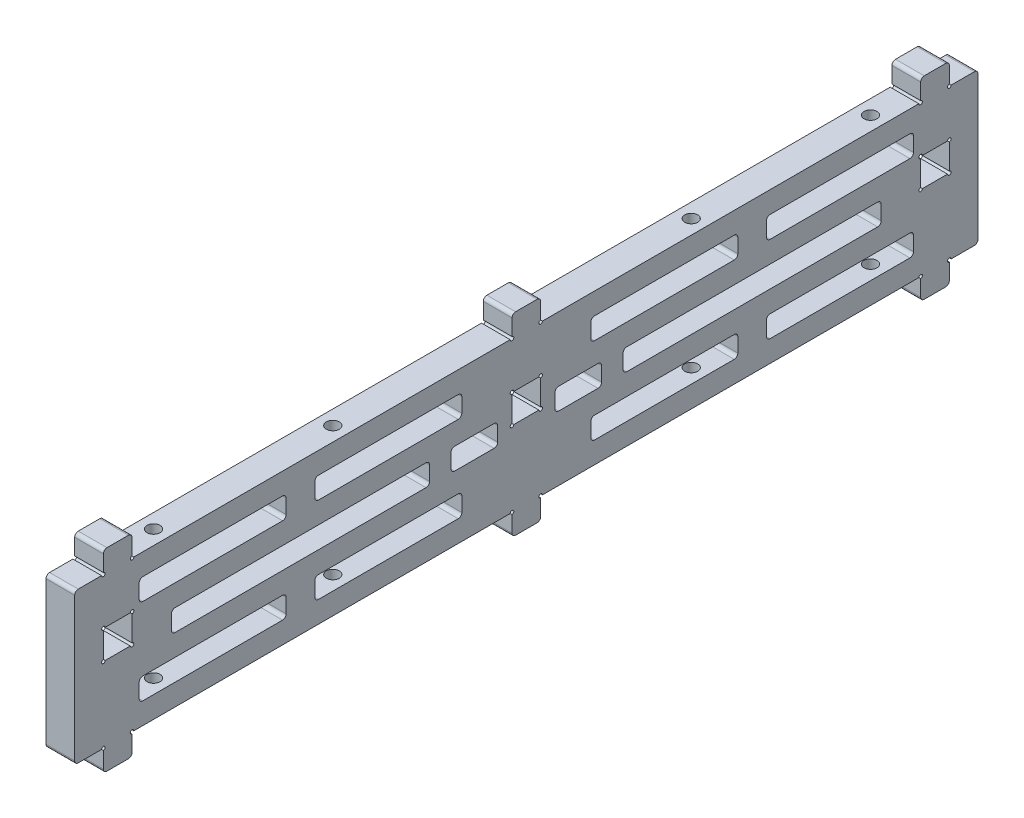
from build123d import *

# Parameters (mm, degrees)
SKETCH_1_W          = 126
SKETCH_1_H          = 21
SKETCH_1_W_2        = 4
SKETCH_1_H_2        = 4
EXTRUDE_1_DEPTH     = 4
EXTRUDE_2_DEPTH     = 4
SKETCH_3_R          = 0.25
CUT_EXTRUDE_1_DEPTH = 4
CUT_EXTRUDE_2_DEPTH = 4
FILLET_1_R          = 0.5
CUT_EXTRUDE_3_REACH = 69.535
SKETCH_5_R          = 0.9


with BuildPart() as part:
    # 草图1 → 凸台-拉伸1 (new body)
    with BuildSketch(Plane(origin=(0, 0, 0), x_dir=(0, 0, -1), z_dir=(1, 0, 0))):
        Rectangle(SKETCH_1_W, SKETCH_1_H)
        with Locations((0, 2)):
            Rectangle(SKETCH_1_W_2, SKETCH_1_H_2, mode=Mode.SUBTRACT)
        with Locations((57, 2)):
            Rectangle(SKETCH_1_W_2, SKETCH_1_H_2, mode=Mode.SUBTRACT)
        with Locations((-57, 2)):
            Rectangle(SKETCH_1_W_2, SKETCH_1_H_2, mode=Mode.SUBTRACT)
    extrude(amount=EXTRUDE_1_DEPTH)

    # 草图2 → 凸台-拉伸2 (add)
    with BuildSketch(Plane(origin=(4, 0, 0), x_dir=(0, 0, -1), z_dir=(1, 0, 0))):
        with BuildLine():
            Line((-1.5, 13.5), (1.5, 13.5))
            ThreePointArc((1.5, 13.5), (1.853553391, 13.353553391), (2, 13))
            Line((2, 13), (2, 10.5))
            Line((2, 10.5), (-2, 10.5))
            Line((-2, 10.5), (-2, 13))
            ThreePointArc((-2, 13), (-1.853553391, 13.353553391), (-1.5, 13.5))
        make_face()
        with BuildLine():
            Line((55.5, 13.5), (58.5, 13.5))
            ThreePointArc((58.5, 13.5), (58.853553391, 13.353553391), (59, 13))
            Line((59, 13), (59, 10.5))
            Line((59, 10.5), (55, 10.5))
            Line((55, 10.5), (55, 13))
            ThreePointArc((55, 13), (55.146446609, 13.353553391), (55.5, 13.5))
        make_face()
        with BuildLine():
            Line((-55, 10.5), (-59, 10.5))
            Line((-59, 10.5), (-59, 13))
            ThreePointArc((-59, 13), (-58.853553391, 13.353553391), (-58.5, 13.5))
            Line((-58.5, 13.5), (-55.5, 13.5))
            ThreePointArc((-55.5, 13.5), (-55.146446609, 13.353553391), (-55, 13))
            Line((-55, 13), (-55, 10.5))
        make_face()
        with BuildLine():
            Line((-55.5, -13.5), (-58.5, -13.5))
            ThreePointArc((-58.5, -13.5), (-58.853553391, -13.353553391), (-59, -13))
            Line((-59, -13), (-59, -10.5))
            Line((-59, -10.5), (-55, -10.5))
            Line((-55, -10.5), (-55, -13))
            ThreePointArc((-55, -13), (-55.146446609, -13.353553391), (-55.5, -13.5))
        make_face()
        with BuildLine():
            Line((-2, -10.5), (2, -10.5))
            Line((2, -10.5), (2, -13))
            ThreePointArc((2, -13), (1.853553391, -13.353553391), (1.5, -13.5))
            Line((1.5, -13.5), (-1.5, -13.5))
            ThreePointArc((-1.5, -13.5), (-1.853553391, -13.353553391), (-2, -13))
            Line((-2, -13), (-2, -10.5))
        make_face()
        with BuildLine():
            Line((55, -10.5), (59, -10.5))
            Line((59, -10.5), (59, -13))
            ThreePointArc((59, -13), (58.853553391, -13.353553391), (58.5, -13.5))
            Line((58.5, -13.5), (55.5, -13.5))
            ThreePointArc((55.5, -13.5), (55.146446609, -13.353553391), (55, -13))
            Line((55, -13), (55, -10.5))
        make_face()
    extrude(amount=-EXTRUDE_2_DEPTH)

    # 草图3 → 切除-拉伸1 (cut)
    with BuildSketch(Plane(origin=(4, 0, 0), x_dir=(0, 0, -1), z_dir=(1, 0, 0))):
        with Locations((59, 10.5)):
            Circle(SKETCH_3_R)
        with Locations((55, 10.5)):
            Circle(SKETCH_3_R)
        with Locations((2, 10.5)):
            Circle(SKETCH_3_R)
        with Locations((-2, 10.5)):
            Circle(SKETCH_3_R)
        with Locations((-55, 10.5)):
            Circle(SKETCH_3_R)
        with Locations((-59, 10.5)):
            Circle(SKETCH_3_R)
        with Locations((-59, -10.5)):
            Circle(SKETCH_3_R)
        with Locations((-55, -10.5)):
            Circle(SKETCH_3_R)
        with Locations((-2, -10.5)):
            Circle(SKETCH_3_R)
        with Locations((2, -10.5)):
            Circle(SKETCH_3_R)
        with Locations((55, -10.5)):
            Circle(SKETCH_3_R)
        with Locations((59, -10.5)):
            Circle(SKETCH_3_R)
        with Locations((-55, 0)):
            Circle(SKETCH_3_R)
        with Locations((-55, 4)):
            Circle(SKETCH_3_R)
        with Locations((-59, 4)):
            Circle(SKETCH_3_R)
        with Locations((-59, 0)):
            Circle(SKETCH_3_R)
        with Locations((-2, 0)):
            Circle(SKETCH_3_R)
        with Locations((-2, 4)):
            Circle(SKETCH_3_R)
        with Locations((59, 4)):
            Circle(SKETCH_3_R)
        with Locations((59, 0)):
            Circle(SKETCH_3_R)
        with Locations((55, 0)):
            Circle(SKETCH_3_R)
        with Locations((55, 4)):
            Circle(SKETCH_3_R)
        with Locations((2, 4)):
            Circle(SKETCH_3_R)
        with Locations((2, 0)):
            Circle(SKETCH_3_R)
    extrude(amount=-CUT_EXTRUDE_1_DEPTH, mode=Mode.SUBTRACT)

    # 草图4 → 切除-拉伸2 (cut)
    with BuildSketch(Plane(origin=(4, 0, 0), x_dir=(0, 0, -1), z_dir=(1, 0, 0))):
        with BuildLine():
            Line((-53.5, 7.5), (-34, 7.5))
            ThreePointArc((-34, 7.5), (-33.646446609, 7.353553391), (-33.5, 7))
            Line((-33.5, 7), (-33.5, 5))
            ThreePointArc((-33.5, 5), (-33.646446609, 4.646446609), (-34, 4.5))
            Line((-34, 4.5), (-53.5, 4.5))
            ThreePointArc((-53.5, 4.5), (-53.853553391, 4.646446609), (-54, 5))
            Line((-54, 5), (-54, 7))
            ThreePointArc((-54, 7), (-53.853553391, 7.353553391), (-53.5, 7.5))
        make_face()
        with BuildLine():
            Line((-9.5, 4.5), (-29, 4.5))
            ThreePointArc((-29, 4.5), (-29.353553391, 4.646446609), (-29.5, 5))
            Line((-29.5, 5), (-29.5, 7))
            ThreePointArc((-29.5, 7), (-29.353553391, 7.353553391), (-29, 7.5))
            Line((-29, 7.5), (-9.5, 7.5))
            ThreePointArc((-9.5, 7.5), (-9.146446609, 7.353553391), (-9, 7))
            Line((-9, 7), (-9, 5))
            ThreePointArc((-9, 5), (-9.146446609, 4.646446609), (-9.5, 4.5))
        make_face()
        with BuildLine():
            Line((-53.5, -4.5), (-34, -4.5))
            ThreePointArc((-34, -4.5), (-33.646446609, -4.646446609), (-33.5, -5))
            Line((-33.5, -5), (-33.5, -7))
            ThreePointArc((-33.5, -7), (-33.646446609, -7.353553391), (-34, -7.5))
            Line((-34, -7.5), (-53.5, -7.5))
            ThreePointArc((-53.5, -7.5), (-53.853553391, -7.353553391), (-54, -7))
            Line((-54, -7), (-54, -5))
            ThreePointArc((-54, -5), (-53.853553391, -4.646446609), (-53.5, -4.5))
        make_face()
        with BuildLine():
            Line((-9.5, -4.5), (-29, -4.5))
            ThreePointArc((-29, -4.5), (-29.353553391, -4.646446609), (-29.5, -5))
            Line((-29.5, -5), (-29.5, -7))
            ThreePointArc((-29.5, -7), (-29.353553391, -7.353553391), (-29, -7.5))
            Line((-29, -7.5), (-9.5, -7.5))
            ThreePointArc((-9.5, -7.5), (-9.146446609, -7.353553391), (-9, -7))
            Line((-9, -7), (-9, -5))
            ThreePointArc((-9, -5), (-9.146446609, -4.646446609), (-9.5, -4.5))
        make_face()
        with BuildLine():
            Line((-49, 1.5), (-14, 1.5))
            ThreePointArc((-14, 1.5), (-13.646446609, 1.353553391), (-13.5, 1))
            Line((-13.5, 1), (-13.5, -1))
            ThreePointArc((-13.5, -1), (-13.646446609, -1.353553391), (-14, -1.5))
            Line((-14, -1.5), (-49, -1.5))
            ThreePointArc((-49, -1.5), (-49.353553391, -1.353553391), (-49.5, -1))
            Line((-49.5, -1), (-49.5, 1))
            ThreePointArc((-49.5, 1), (-49.353553391, 1.353553391), (-49, 1.5))
        make_face()
        with BuildLine():
            Line((-10, 1.5), (-4.5, 1.5))
            ThreePointArc((-4.5, 1.5), (-4.146446609, 1.353553391), (-4, 1))
            Line((-4, 1), (-4, -1))
            ThreePointArc((-4, -1), (-4.146446609, -1.353553391), (-4.5, -1.5))
            Line((-4.5, -1.5), (-10, -1.5))
            ThreePointArc((-10, -1.5), (-10.353553391, -1.353553391), (-10.5, -1))
            Line((-10.5, -1), (-10.5, 1))
            ThreePointArc((-10.5, 1), (-10.353553391, 1.353553391), (-10, 1.5))
        make_face()
        with BuildLine():
            Line((49, -1.5), (14, -1.5))
            ThreePointArc((14, -1.5), (13.646446609, -1.353553391), (13.5, -1))
            Line((13.5, -1), (13.5, 1))
            ThreePointArc((13.5, 1), (13.646446609, 1.353553391), (14, 1.5))
            Line((14, 1.5), (49, 1.5))
            ThreePointArc((49, 1.5), (49.353553391, 1.353553391), (49.5, 1))
            Line((49.5, 1), (49.5, -1))
            ThreePointArc((49.5, -1), (49.353553391, -1.353553391), (49, -1.5))
        make_face()
        with BuildLine():
            Line((10, -1.5), (4.5, -1.5))
            ThreePointArc((4.5, -1.5), (4.146446609, -1.353553391), (4, -1))
            Line((4, -1), (4, 1))
            ThreePointArc((4, 1), (4.146446609, 1.353553391), (4.5, 1.5))
            Line((4.5, 1.5), (10, 1.5))
            ThreePointArc((10, 1.5), (10.353553391, 1.353553391), (10.5, 1))
            Line((10.5, 1), (10.5, -1))
            ThreePointArc((10.5, -1), (10.353553391, -1.353553391), (10, -1.5))
        make_face()
        with BuildLine():
            Line((9, -7), (9, -5))
            ThreePointArc((9, -5), (9.146446609, -4.646446609), (9.5, -4.5))
            Line((9.5, -4.5), (29, -4.5))
            ThreePointArc((29, -4.5), (29.353553391, -4.646446609), (29.5, -5))
            Line((29.5, -5), (29.5, -7))
            ThreePointArc((29.5, -7), (29.353553391, -7.353553391), (29, -7.5))
            Line((29, -7.5), (9.5, -7.5))
            ThreePointArc((9.5, -7.5), (9.146446609, -7.353553391), (9, -7))
        make_face()
        with BuildLine():
            Line((53.5, -4.5), (34, -4.5))
            ThreePointArc((34, -4.5), (33.646446609, -4.646446609), (33.5, -5))
            Line((33.5, -5), (33.5, -7))
            ThreePointArc((33.5, -7), (33.646446609, -7.353553391), (34, -7.5))
            Line((34, -7.5), (53.5, -7.5))
            ThreePointArc((53.5, -7.5), (53.853553391, -7.353553391), (54, -7))
            Line((54, -7), (54, -5))
            ThreePointArc((54, -5), (53.853553391, -4.646446609), (53.5, -4.5))
        make_face()
        with BuildLine():
            Line((53.5, 4.5), (34, 4.5))
            ThreePointArc((34, 4.5), (33.646446609, 4.646446609), (33.5, 5))
            Line((33.5, 5), (33.5, 7))
            ThreePointArc((33.5, 7), (33.646446609, 7.353553391), (34, 7.5))
            Line((34, 7.5), (53.5, 7.5))
            ThreePointArc((53.5, 7.5), (53.853553391, 7.353553391), (54, 7))
            Line((54, 7), (54, 5))
            ThreePointArc((54, 5), (53.853553391, 4.646446609), (53.5, 4.5))
        make_face()
        with BuildLine():
            Line((9.5, 4.5), (29, 4.5))
            ThreePointArc((29, 4.5), (29.353553391, 4.646446609), (29.5, 5))
            Line((29.5, 5), (29.5, 7))
            ThreePointArc((29.5, 7), (29.353553391, 7.353553391), (29, 7.5))
            Line((29, 7.5), (9.5, 7.5))
            ThreePointArc((9.5, 7.5), (9.146446609, 7.353553391), (9, 7))
            Line((9, 7), (9, 5))
            ThreePointArc((9, 5), (9.146446609, 4.646446609), (9.5, 4.5))
        make_face()
    extrude(amount=-CUT_EXTRUDE_2_DEPTH, mode=Mode.SUBTRACT)

    # 圆角1
    fillet_1_edges = [part.edges().sort_by_distance(p)[0] for p in [
        (2, -10.5, -63),
        (2, -10.5, 63),
        (2, 10.5, 63),
        (2, 10.5, -63),
    ]]
    fillet(fillet_1_edges, radius=FILLET_1_R)

    # 草图5 → 切除-拉伸3 (cut, up to next)
    with BuildSketch(Plane(origin=(0, 10.5, 0), x_dir=(1, 0, 0), z_dir=(0, 1, 0)), mode=Mode.PRIVATE) as cut_extrude_3_sk1:
        with Locations(Location((2, 25, 0), (0, 0, 270))):
            Circle(SKETCH_5_R)
    cut_extrude_3_tool1 = extrude(cut_extrude_3_sk1.sketch, amount=-CUT_EXTRUDE_3_REACH, mode=Mode.PRIVATE) & part.part
    # 草图5 → 切除-拉伸3 (cut, up to next)
    with BuildSketch(Plane(origin=(0, 10.5, 0), x_dir=(1, 0, 0), z_dir=(0, 1, 0)), mode=Mode.PRIVATE) as cut_extrude_3_sk2:
        with Locations(Location((2, 50, 0), (0, 0, 270))):
            Circle(SKETCH_5_R)
    cut_extrude_3_tool2 = extrude(cut_extrude_3_sk2.sketch, amount=-CUT_EXTRUDE_3_REACH, mode=Mode.PRIVATE) & part.part
    # 草图5 → 切除-拉伸3 (cut, up to next)
    with BuildSketch(Plane(origin=(0, 10.5, 0), x_dir=(1, 0, 0), z_dir=(0, 1, 0)), mode=Mode.PRIVATE) as cut_extrude_3_sk3:
        with Locations(Location((2, -50, 0), (0, 0, 270))):
            Circle(SKETCH_5_R)
    cut_extrude_3_tool3 = extrude(cut_extrude_3_sk3.sketch, amount=-CUT_EXTRUDE_3_REACH, mode=Mode.PRIVATE) & part.part
    # 草图5 → 切除-拉伸3 (cut, up to next)
    with BuildSketch(Plane(origin=(0, 10.5, 0), x_dir=(1, 0, 0), z_dir=(0, 1, 0)), mode=Mode.PRIVATE) as cut_extrude_3_sk4:
        with Locations(Location((2, -25, 0), (0, 0, 270))):
            Circle(SKETCH_5_R)
    cut_extrude_3_tool4 = extrude(cut_extrude_3_sk4.sketch, amount=-CUT_EXTRUDE_3_REACH, mode=Mode.PRIVATE) & part.part
    cut_extrude_3_1 = cut_extrude_3_tool1.solids().sort_by_distance((2, 10.5, -25))[0]
    add(cut_extrude_3_1, mode=Mode.SUBTRACT)
    cut_extrude_3_2 = cut_extrude_3_tool2.solids().sort_by_distance((2, 10.5, -50))[0]
    add(cut_extrude_3_2, mode=Mode.SUBTRACT)
    cut_extrude_3_3 = cut_extrude_3_tool3.solids().sort_by_distance((2, 10.5, 50))[0]
    add(cut_extrude_3_3, mode=Mode.SUBTRACT)
    cut_extrude_3_4 = cut_extrude_3_tool4.solids().sort_by_distance((2, 10.5, 25))[0]
    add(cut_extrude_3_4, mode=Mode.SUBTRACT)
    cut_extrude_3 = cut_extrude_3_1 + cut_extrude_3_2 + cut_extrude_3_3 + cut_extrude_3_4  # 切除-拉伸3 as one shape, for the pattern or mirror that repeats it

    # 镜向1: 切除-拉伸3 across plane
    add(cut_extrude_3.mirror(Plane.ZX), mode=Mode.SUBTRACT)


solid = part.part
